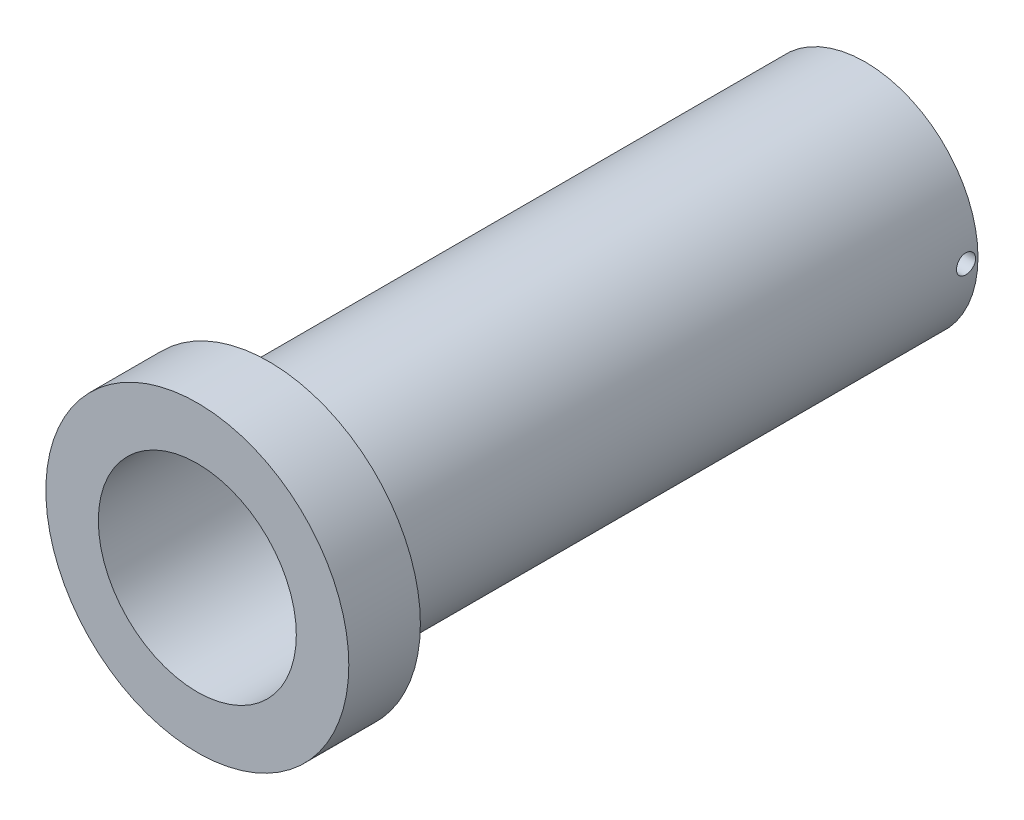
from build123d import *

# Parameters (mm, degrees)
SKETCH1_R             = 9.45
SKETCH1_R_2           = 8.3
BOSS_EXTRUDE1_DEPTH   = 50
SKETCH2_R             = 12.7
SKETCH2_R_2           = 8.3
BOSS_EXTRUDE2_DEPTH   = 6
M2X0_4_TAPPED_HOLE1_D = 1.6


with BuildPart() as part:
    # Sketch1 → Boss-Extrude1 (new body)
    with BuildSketch(Plane.XY):
        with Locations((12.733633013, -2.883668241)):
            Circle(SKETCH1_R)
        with Locations((12.733633013, -2.883668241)):
            Circle(SKETCH1_R_2, mode=Mode.SUBTRACT)
    extrude(amount=BOSS_EXTRUDE1_DEPTH)

    # Sketch2 → Boss-Extrude2 (add)
    with BuildSketch(Plane.XY.offset(50)):
        with Locations((12.733633013, -2.883668241)):
            Circle(SKETCH2_R)
        with Locations((12.733633013, -2.883668241)):
            Circle(SKETCH2_R_2, mode=Mode.SUBTRACT)
    extrude(amount=BOSS_EXTRUDE2_DEPTH)

    # M2x0.4 Tapped Hole1 (through all)
    with Locations(Plane(origin=(22.183633013, -2.883668241, 1), x_dir=(0, 1, 0), z_dir=(1, 0, 0))):
        with Locations((0, 0)):
            Hole(M2X0_4_TAPPED_HOLE1_D / 2)


solid = part.part
